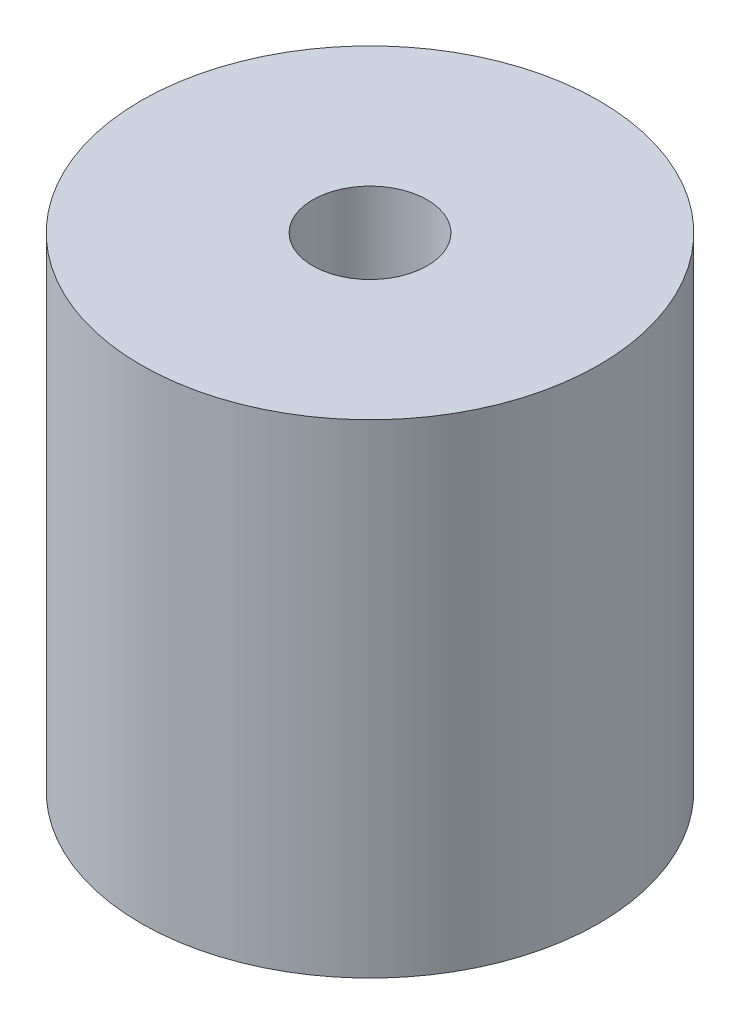
from build123d import *

# Parameters (mm, degrees)
SKETCH1_R           = 6.35
SKETCH1_R_2         = 1.5875
BOSS_EXTRUDE1_DEPTH = 13.41


with BuildPart() as part:
    # Sketch1 → Boss-Extrude1 (new body)
    with BuildSketch(Plane(origin=(0, 0, 0), x_dir=(1, 0, 0), z_dir=(0, 1, 0))):
        with Locations(Location((0, 0, 0), (0, 0, 90))):
            Circle(SKETCH1_R)
        with Locations(Location((0, 0, 0), (0, 0, 90))):
            Circle(SKETCH1_R_2, mode=Mode.SUBTRACT)
    extrude(amount=BOSS_EXTRUDE1_DEPTH)


solid = part.part
